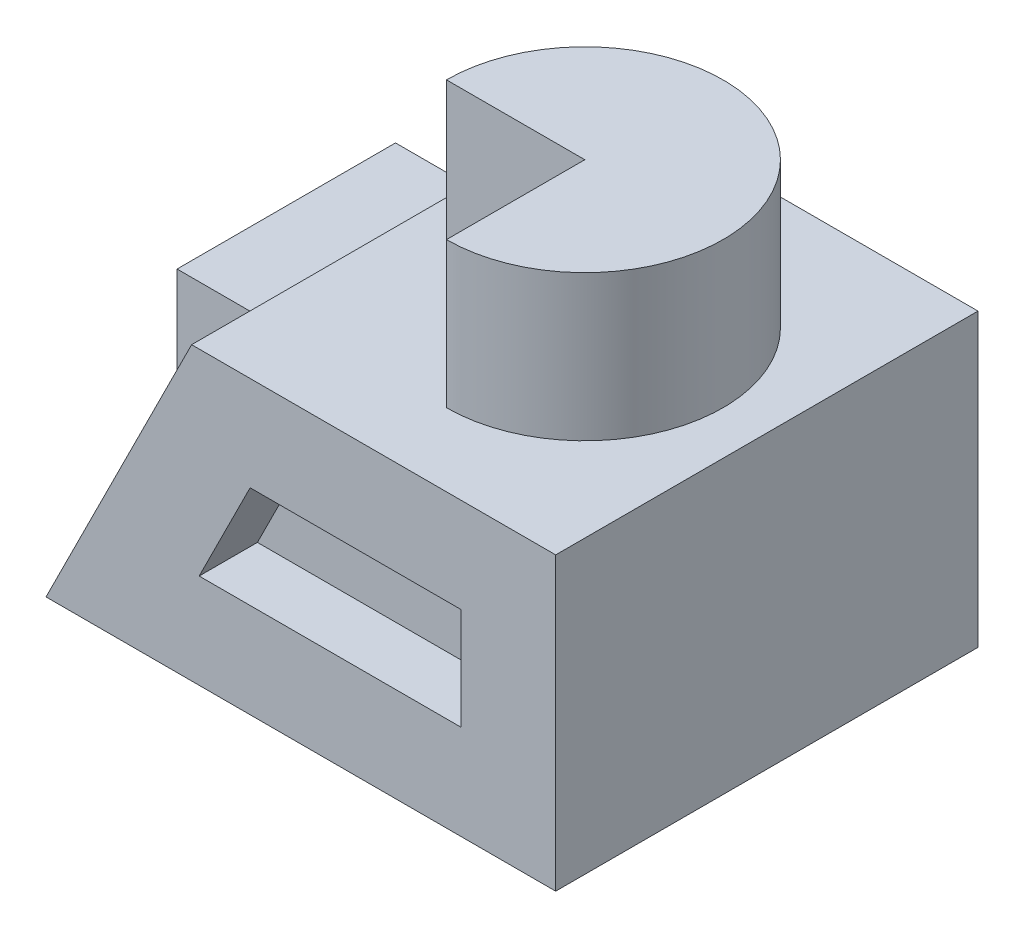
from build123d import *

# Parameters (mm, degrees)
EXTRUDE_1_DEPTH      = 58
EXTRUDE_2_DEPTH      = 20
CUT_EXTRUDE_1_DEPTH  = 8
EXTRUDE_3_DEPTH      = 15
EXTRUDE_3_DEPTH_BACK = 15


with BuildPart() as part:
    # Эскиз1 → Бобышка-Вытянуть1 (new body)
    with BuildSketch(Plane.XY):
        Polygon((-15, 20), (-35, -20), (35, -20), (35, 20), align=None)
    extrude(amount=EXTRUDE_1_DEPTH)

    # Эскиз2 → Бобышка-Вытянуть2 (add)
    with BuildSketch(Plane(origin=(0, 20, 0), x_dir=(1, 0, 0), z_dir=(0, 1, 0))):
        with BuildLine():
            Line((29, -29), (10, -29))
            Line((10, -29), (10, -48))
            ThreePointArc((10, -48), (23.435028843, -42.435028843), (29, -29))
        make_face()
        with BuildLine():
            ThreePointArc((29, -29), (10, -10), (-9, -29))
            Line((-9, -29), (10, -29))
            Line((10, -29), (29, -29))
        make_face()
    extrude(amount=EXTRUDE_2_DEPTH)

    # Эскиз3 → Вырез-Вытянуть1 (cut)
    with BuildSketch(Plane.XY.offset(58)):
        Polygon((22, -7), (22, 7), (-6.965558146, 7), (-13.965558146, -7), align=None)
    extrude(amount=-CUT_EXTRUDE_1_DEPTH, mode=Mode.SUBTRACT)

    # Эскиз4 → Бобышка-Вытянуть3 (add, two sides: drawn at the far end of the back side and taken through both)
    with BuildSketch(Plane.XY.offset(29).offset(-EXTRUDE_3_DEPTH_BACK)):
        Polygon((-31, -12), (-31, 14), (-18, 14), align=None)
    extrude(amount=EXTRUDE_3_DEPTH + EXTRUDE_3_DEPTH_BACK)


solid = part.part
